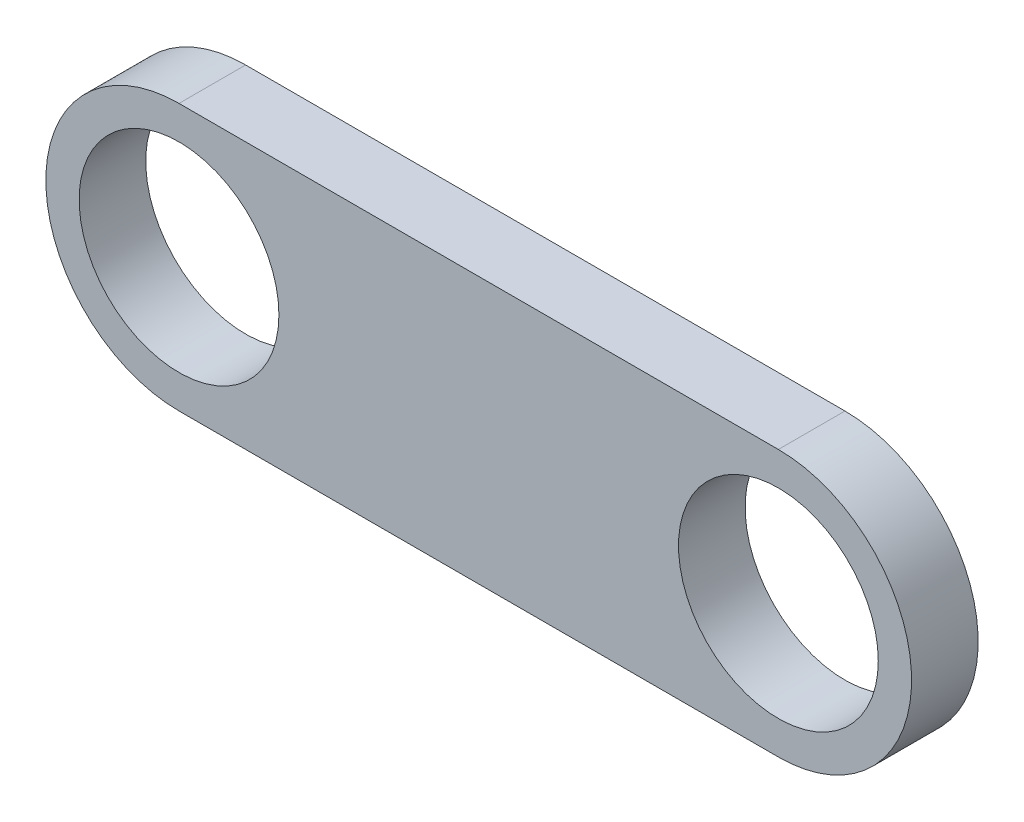
from build123d import *

# Parameters (mm, degrees)
SKETCH_1_R      = 15
EXTRUDE_2_DEPTH = 10


with BuildPart() as part:
    # Эскиз1 → Бобышка-Вытянуть2 (new body)
    with BuildSketch(Plane.XY):
        with BuildLine():
            Line((0, 20), (90, 20))
            ThreePointArc((90, 20), (110, 0), (90, -20))
            Line((90, -20), (0, -20))
            ThreePointArc((0, -20), (-20, 0), (0, 20))
        make_face()
        Circle(SKETCH_1_R, mode=Mode.SUBTRACT)
        with Locations((90, 0)):
            Circle(SKETCH_1_R, mode=Mode.SUBTRACT)
    extrude(amount=EXTRUDE_2_DEPTH)


solid = part.part
